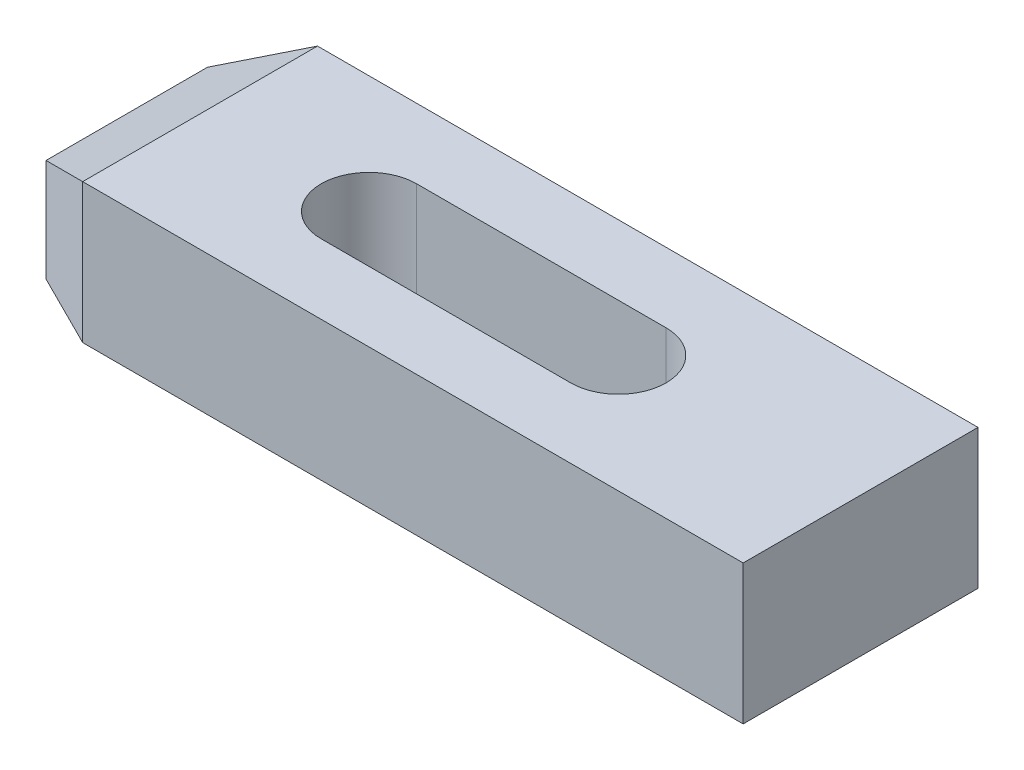
from build123d import *

# Parameters (mm, degrees)
BOSS_EXTRUDE1_DEPTH = 19
CUT_EXTRUDE1_DEPTH  = 63.329768169


with BuildPart() as part:
    # Sketch1 → Boss-Extrude1 (new body)
    with BuildSketch(Plane(origin=(0, 0, 0), x_dir=(1, 0, 0), z_dir=(0, 1, 0))):
        Polygon((-40, -16), (50, -16), (50, 16), (-40, 16), (-50, 11), (-50, -11), align=None)
        with BuildLine():
            Line((-17, 6.5), (17, 6.5))
            ThreePointArc((17, 6.5), (23.5, 0), (17, -6.5))
            Line((17, -6.5), (-17, -6.5))
            ThreePointArc((-17, -6.5), (-23.5, 0), (-17, 6.5))
        make_face(mode=Mode.SUBTRACT)
    extrude(amount=BOSS_EXTRUDE1_DEPTH)

    # Sketch2 → Cut-Extrude1 (cut, through all)
    with BuildSketch(Plane.XY.offset(16)):
        Polygon((-50, 19), (-40, 19), (-50, 14), align=None)
    extrude(amount=-CUT_EXTRUDE1_DEPTH, mode=Mode.SUBTRACT)


solid = part.part
